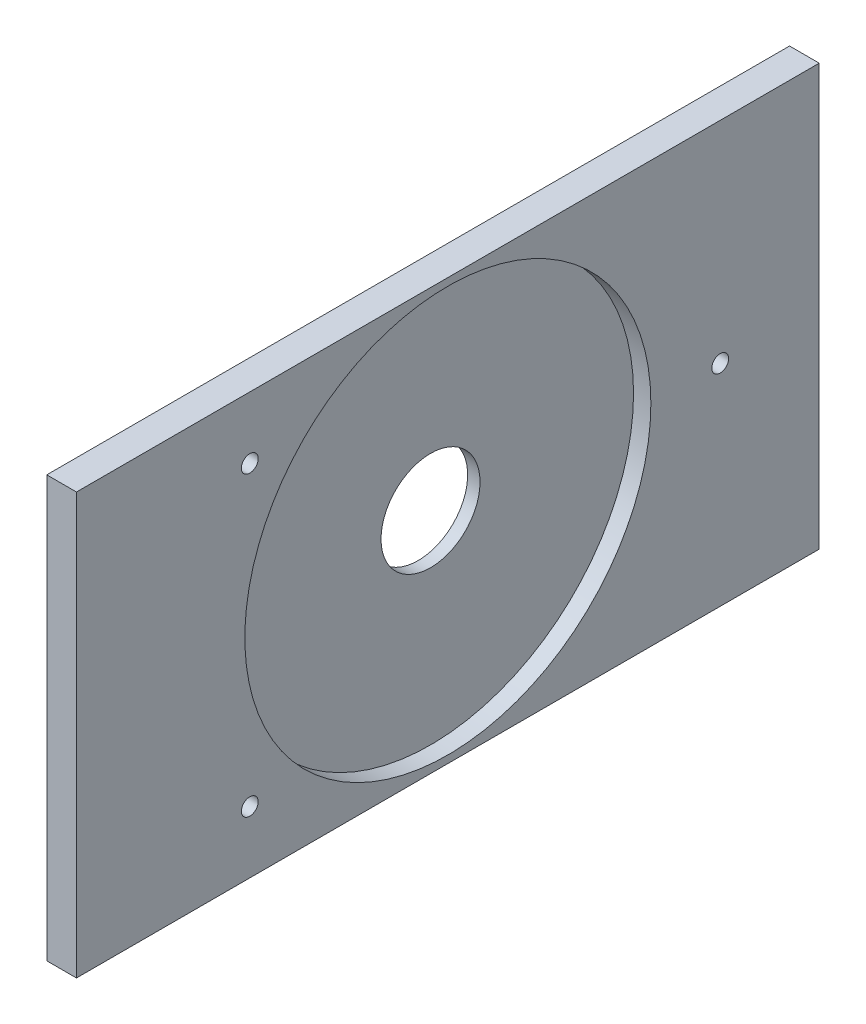
from build123d import *

# Parameters (mm, degrees)
BOSS_EXTRUDE1_DEPTH      = 3.5
BOSS_EXTRUDE1_DEPTH_BACK = 2.5
SKETCH1_W                = 150
SKETCH1_H                = 85
SKETCH4_R                = 41
CUT_EXTRUDE2_DEPTH       = 3.5
SKETCH5_R                = 10
CUT_EXTRUDE3_DEPTH       = 750.782985078
SKETCH8_R                = 1.7
CUT_EXTRUDE5_DEPTH       = 750.782985078


with BuildPart() as part:
    # Sketch1 → Boss-Extrude1 (new, two sides: drawn at the far end of the back side and taken through both)
    with BuildSketch(Plane.ZY.offset(34.241420021).offset(-BOSS_EXTRUDE1_DEPTH_BACK)):
        with Locations((461.309777683, 481.437350332)):
            Rectangle(SKETCH1_W, SKETCH1_H)
    extrude(amount=BOSS_EXTRUDE1_DEPTH + BOSS_EXTRUDE1_DEPTH_BACK)

    # Sketch4 → Cut-Extrude2 (cut)
    with BuildSketch(Plane(origin=(-31.741420021, 0, 0), x_dir=(0, 0, -1), z_dir=(1, 0, 0))):
        with Locations((-461.309777683, 481.437350332)):
            Circle(SKETCH4_R)
    extrude(amount=-CUT_EXTRUDE2_DEPTH, mode=Mode.SUBTRACT)

    # Sketch5 → Cut-Extrude3 (cut, through all)
    with BuildSketch(Plane.ZY.offset(37.741420021)):
        with Locations((461.309777683, 481.437350332)):
            Circle(SKETCH5_R)
    extrude(amount=-CUT_EXTRUDE3_DEPTH, mode=Mode.SUBTRACT)

    # Sketch8 → Cut-Extrude5 (cut, through all)
    with BuildSketch(Plane.ZY.offset(37.741420021)):
        with Locations((501.309777683, 511.437350332)):
            Circle(SKETCH8_R)
        with Locations((406.309777683, 481.437350332)):
            Circle(SKETCH8_R)
        with Locations((501.309777683, 451.437350332)):
            Circle(SKETCH8_R)
    extrude(amount=-CUT_EXTRUDE5_DEPTH, mode=Mode.SUBTRACT)


solid = part.part
